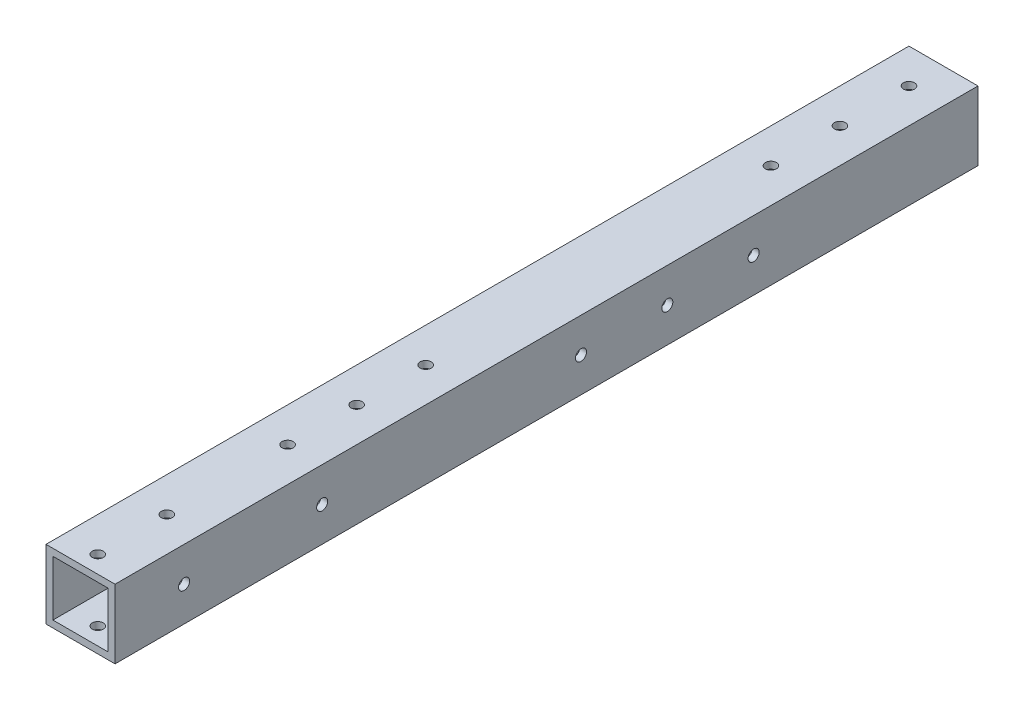
from build123d import *

# Parameters (mm, degrees)
SKETCH_1_W          = 20
SKETCH_1_H          = 20
SKETCH_1_W_2        = 16
SKETCH_1_H_2        = 16
EXTRUDE_1_DEPTH     = 250
SKETCH_2_R          = 1.6
CUT_EXTRUDE_1_DEPTH = 252.594912508
SKETCH_3_R          = 1.6
CUT_EXTRUDE_2_DEPTH = 252.594912508
SKETCH_4_R          = 1.6
CUT_EXTRUDE_3_DEPTH = 252.594912508
SKETCH_5_R          = 1.6
CUT_EXTRUDE_4_DEPTH = 252.594912508


with BuildPart() as part:
    # 草图1 → 拉伸-薄壁1 (new body)
    with BuildSketch(Plane.XY):
        with Locations((10, 10)):
            Rectangle(SKETCH_1_W, SKETCH_1_H)
        with Locations((10, 10)):
            Rectangle(SKETCH_1_W_2, SKETCH_1_H_2, mode=Mode.SUBTRACT)
    extrude(amount=EXTRUDE_1_DEPTH)

    # 草图2 → 切除-拉伸1 (cut, through all)
    with BuildSketch(Plane.XZ):
        with Locations(Location((10, 10, 0), (0, 0, 270))):
            Circle(SKETCH_2_R)
        with Locations(Location((10, 30, 0), (0, 0, 270))):
            Circle(SKETCH_2_R)
        with Locations(Location((10, 50, 0), (0, 0, 270))):
            Circle(SKETCH_2_R)
    extrude(amount=-CUT_EXTRUDE_1_DEPTH, mode=Mode.SUBTRACT)

    # 草图3 → 切除-拉伸2 (cut, through all)
    with BuildSketch(Plane(origin=(0, 20, 0), x_dir=(1, 0, 0), z_dir=(0, 1, 0))):
        with Locations(Location((10, -150, 0), (0, 0, 270))):
            Circle(SKETCH_3_R)
        with Locations(Location((10, -170, 0), (0, 0, 270))):
            Circle(SKETCH_3_R)
        with Locations(Location((10, -190, 0), (0, 0, 270))):
            Circle(SKETCH_3_R)
        with Locations(Location((10, -245, 0), (0, 0, 270))):
            Circle(SKETCH_3_R)
        with Locations(Location((10, -225, 0), (0, 0, 270))):
            Circle(SKETCH_3_R)
    extrude(amount=-CUT_EXTRUDE_2_DEPTH, mode=Mode.SUBTRACT)

    # 草图4 → 切除-拉伸3 (cut, through all)
    with BuildSketch(Plane(origin=(20, 0, 0), x_dir=(0, 0, -1), z_dir=(1, 0, 0))):
        with Locations((-230, 10)):
            Circle(SKETCH_4_R)
        with Locations((-190, 10)):
            Circle(SKETCH_4_R)
    extrude(amount=-CUT_EXTRUDE_3_DEPTH, mode=Mode.SUBTRACT)

    # 草图5 → 切除-拉伸4 (cut, through all)
    with BuildSketch(Plane(origin=(20, 0, 0), x_dir=(0, 0, -1), z_dir=(1, 0, 0))):
        with Locations((-90, 10)):
            Circle(SKETCH_5_R)
        with Locations((-115, 10)):
            Circle(SKETCH_5_R)
        with Locations((-65, 10)):
            Circle(SKETCH_5_R)
    extrude(amount=-CUT_EXTRUDE_4_DEPTH, mode=Mode.SUBTRACT)


solid = part.part
